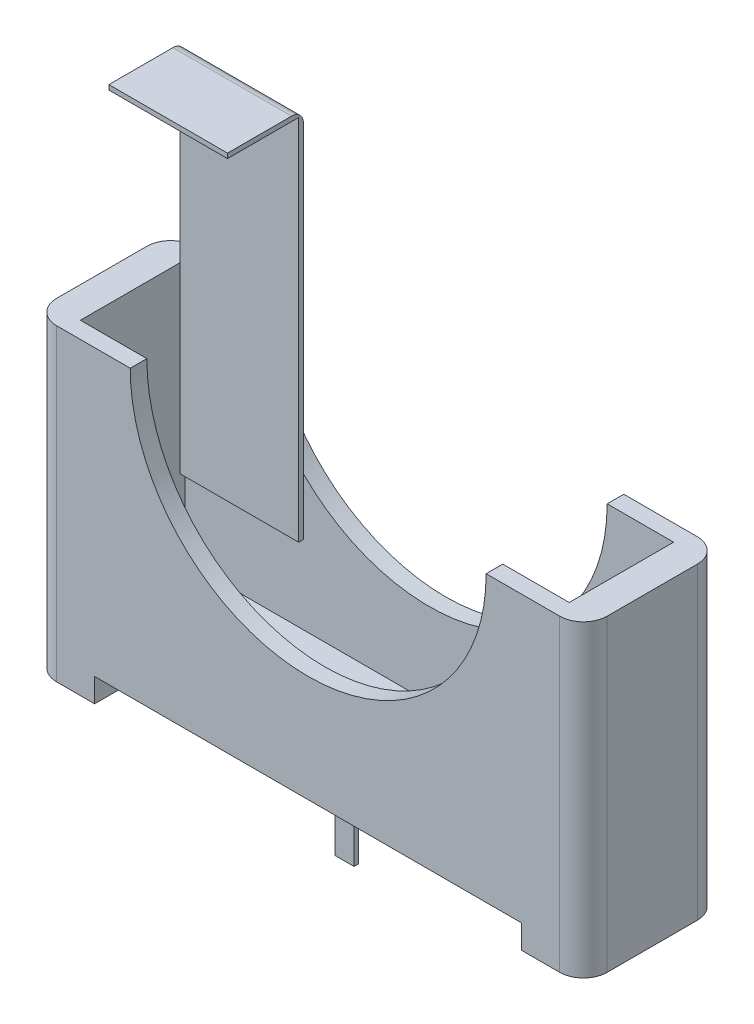
from build123d import *

# Parameters (mm, degrees)
SKETCH1_W           = 23.2
SKETCH1_H           = 5.8
BOSS_EXTRUDE1_DEPTH = 13
SKETCH2_R           = 7.5
SKETCH2_W           = 18
SKETCH2_H           = 5.61118816
CUT_EXTRUDE1_DEPTH  = 19.36300629
SKETCH3_W           = 20.6
SKETCH3_H           = 4.4
CUT_EXTRUDE2_DEPTH  = 11
SKETCH4_W           = 0.8
SKETCH4_H           = 0.2
BOSS_EXTRUDE2_DEPTH = 3
FILLET1_R           = 1
SKETCH5_W           = 5
SKETCH5_H           = 15.702848837
BOSS_EXTRUDE3_DEPTH = 0.2
SKETCH6_W           = 5
SKETCH6_H           = 0.2
BOSS_EXTRUDE4_DEPTH = 3
FILLET2_R           = 0.5


with BuildPart() as part:
    # Sketch1 → Boss-Extrude1 (new body)
    with BuildSketch(Plane(origin=(0, 0, 0), x_dir=(1, 0, 0), z_dir=(0, 1, 0))):
        Rectangle(SKETCH1_W, SKETCH1_H)
    extrude(amount=BOSS_EXTRUDE1_DEPTH)

    # Sketch2 → Cut-Extrude1 (cut, through all)
    with BuildSketch(Plane.XY.offset(2.9)):
        with Locations((0, 13)):
            Circle(SKETCH2_R)
        with Locations((0, -1.80559408)):
            Rectangle(SKETCH2_W, SKETCH2_H)
    extrude(amount=-CUT_EXTRUDE1_DEPTH, mode=Mode.SUBTRACT)

    # Sketch3 → Cut-Extrude2 (cut)
    with BuildSketch(Plane(origin=(0, 13, 0), x_dir=(1, 0, 0), z_dir=(0, 1, 0))):
        Rectangle(SKETCH3_W, SKETCH3_H)
    extrude(amount=-CUT_EXTRUDE2_DEPTH, mode=Mode.SUBTRACT)

    # Sketch4 → Boss-Extrude2 (add)
    with BuildSketch(Plane.XZ.offset(-1)):
        with Locations((0, 1.27)):
            Rectangle(SKETCH4_W, SKETCH4_H)
        with Locations((-5.08, -1.27)):
            Rectangle(SKETCH4_W, SKETCH4_H)
        with Locations((5.08, -1.27)):
            Rectangle(SKETCH4_W, SKETCH4_H)
    extrude(amount=BOSS_EXTRUDE2_DEPTH)

    # Fillet1
    fillet1_edges = [part.edges().sort_by_distance(p)[0] for p in [
        (11.6, 6.5, 2.9),
        (-11.6, 6.5, 2.9),
        (-11.6, 6.5, -2.9),
        (11.6, 6.5, -2.9),
    ]]
    fillet(fillet1_edges, radius=FILLET1_R)

    # Sketch5 → Boss-Extrude3 (add)
    with BuildSketch(Plane.XY.offset(-2.2)):
        with Locations((-7.8, 13.148575582)):
            Rectangle(SKETCH5_W, SKETCH5_H)
    extrude(amount=BOSS_EXTRUDE3_DEPTH)

    # Sketch6 → Boss-Extrude4 (add)
    with BuildSketch(Plane.XY.offset(-2)):
        with Locations((-7.8, 20.9)):
            Rectangle(SKETCH6_W, SKETCH6_H)
    extrude(amount=BOSS_EXTRUDE4_DEPTH)

    # Fillet2
    fillet2_edges = [part.edges().sort_by_distance(p)[0] for p in [
        (-7.8, 21, -2.2),
    ]]
    fillet(fillet2_edges, radius=FILLET2_R)


solid = part.part
